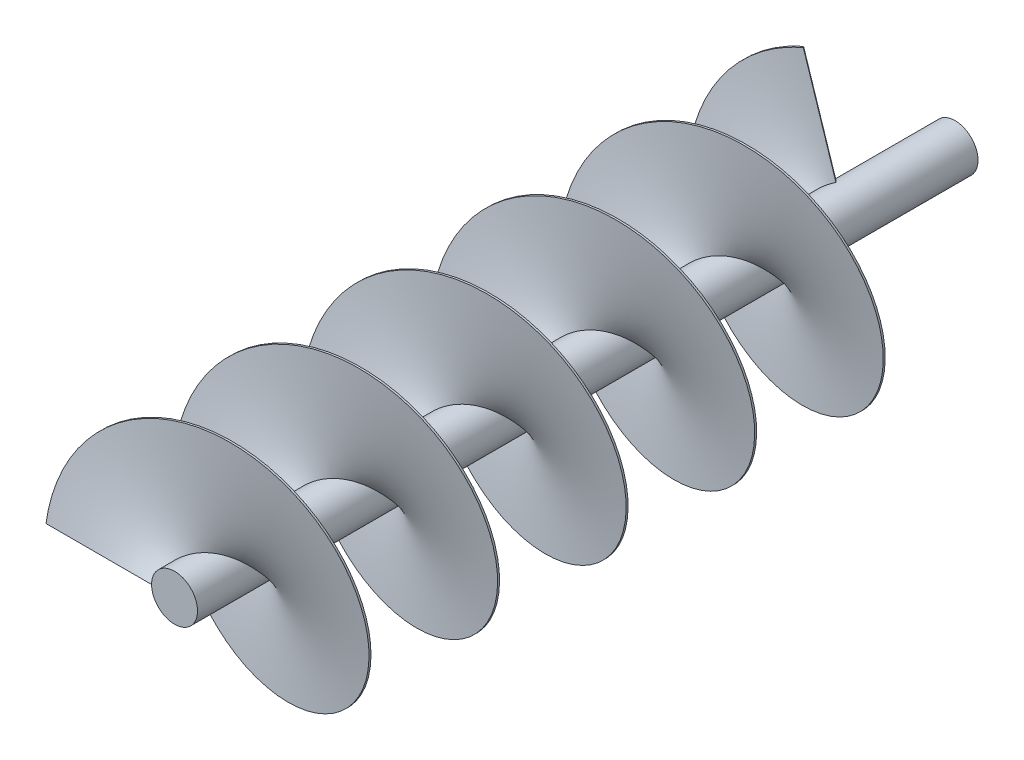
from build123d import *

# Parameters (mm, degrees)
CROQUIS1_R              = 5
SALIENTE_EXTRUIR1_DEPTH = 160
BARRER1_PITCH           = 28
BARRER1_HEIGHT          = 145.6
BARRER1_RADIUS          = 5
CROQUIS3_W              = 23
CROQUIS3_H              = 0.5
CROQUIS4_R              = 3.05
CORTAR_EXTRUIR1_DEPTH   = 10
SALIENTE_EXTRUIR2_START = 10
CROQUIS6_R              = 5
CROQUIS6_R_2            = 3.05
SALIENTE_EXTRUIR2_DEPTH = 10


with BuildPart() as part:
    # Croquis1 → Saliente-Extruir1 (new body)
    with BuildSketch(Plane.XY):
        Circle(CROQUIS1_R)
    extrude(amount=SALIENTE_EXTRUIR1_DEPTH)

    # Croquis4 → Cortar-Extruir1 (cut)
    with BuildSketch(Plane(origin=(0, 0, 0), x_dir=(-1, 0, 0), z_dir=(0, 0, -1))):
        Circle(CROQUIS4_R)
    extrude(amount=-CORTAR_EXTRUIR1_DEPTH, mode=Mode.SUBTRACT)

    # Croquis6 → Saliente-Extruir2 (add)
    with BuildSketch(Plane(origin=(0, 0, 0), x_dir=(-1, 0, 0), z_dir=(0, 0, -1)).offset(SALIENTE_EXTRUIR2_START)):
        Circle(CROQUIS6_R)
        Circle(CROQUIS6_R_2, mode=Mode.SUBTRACT)
    extrude(amount=-SALIENTE_EXTRUIR2_DEPTH)


with BuildPart() as body_2:
    # Barrer1: sweep along a helix
    with BuildLine() as barrer1_path:
        Helix(BARRER1_PITCH, BARRER1_HEIGHT, BARRER1_RADIUS, center=(0, 0, 160), direction=(0, 0, -1))
    # Croquis3 → Barrer1 (sweep)
    with BuildSketch(Plane(origin=(-5, 0, 160), x_dir=(1, 0, 0), z_dir=(-4.925203738521749e-15, 0.746526867675461, -0.6653552703921906))):
        with Locations((-11.5, 0.25)):
            Rectangle(CROQUIS3_W, CROQUIS3_H)
    sweep(path=barrer1_path.line, is_frenet=True)


solid = Compound([part.part, body_2.part])
